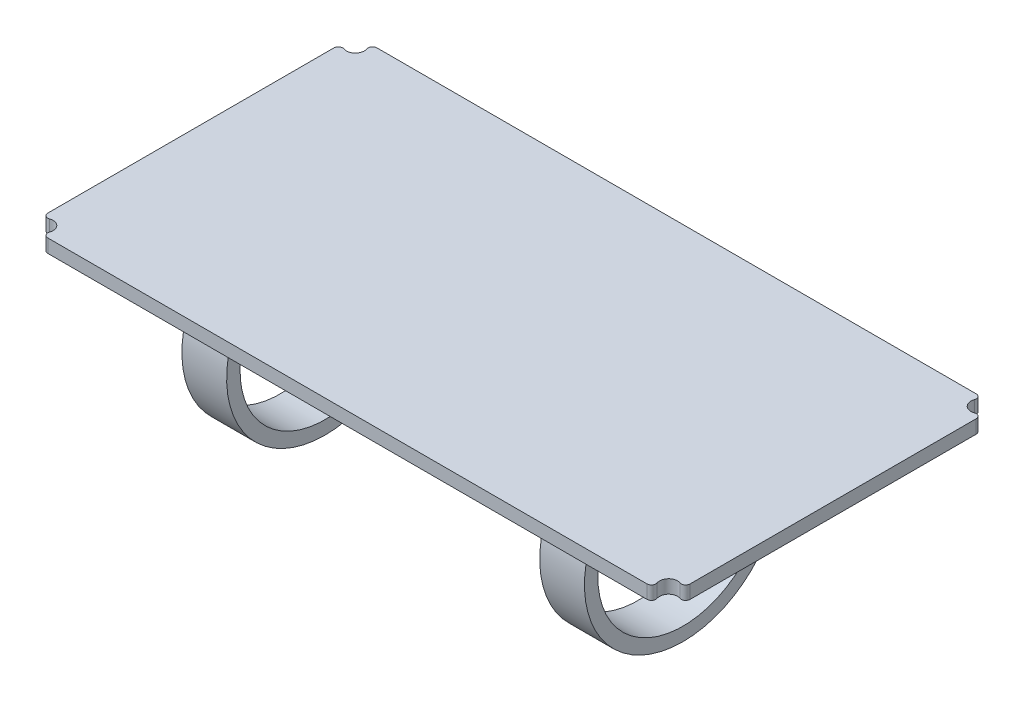
from build123d import *

# Parameters (mm, degrees)
BOSS_EXTRUDE1_DEPTH = 1.5
BOSS_EXTRUDE2_START = -10
BOSS_EXTRUDE2_DEPTH = 5
BOSS_EXTRUDE3_START = -50
BOSS_EXTRUDE3_DEPTH = 5
FILLET1_R           = 5
SKETCH4_R           = 1.1
CUT_EXTRUDE1_DEPTH  = 1.5
SKETCH5_R           = 0.85
CUT_EXTRUDE2_DEPTH  = 6


with BuildPart() as part:
    # Sketch1 → Boss-Extrude1 (new body)
    with BuildSketch(Plane(origin=(0, 0, 0), x_dir=(1, 0, 0), z_dir=(0, 1, 0))):
        with BuildLine():
            Line((2.414213562, 0), (69.385786438, 0))
            ThreePointArc((69.385786438, 0), (69.794034728, 0.211324865), (69.857190958, 0.666666667))
            ThreePointArc((69.857190958, 0.666666667), (70.092893219, 1.707106781), (71.133333333, 1.942809042))
            ThreePointArc((71.133333333, 1.942809042), (71.588675135, 2.005965272), (71.8, 2.414213562))
            Line((71.8, 2.414213562), (71.8, 34.385786438))
            ThreePointArc((71.8, 34.385786438), (71.588675135, 34.794034728), (71.133333333, 34.857190958))
            ThreePointArc((71.133333333, 34.857190958), (70.092893219, 35.092893219), (69.857190958, 36.133333333))
            ThreePointArc((69.857190958, 36.133333333), (69.794034728, 36.588675135), (69.385786438, 36.8))
            Line((69.385786438, 36.8), (2.414213562, 36.8))
            ThreePointArc((2.414213562, 36.8), (2.005965272, 36.588675135), (1.942809042, 36.133333333))
            ThreePointArc((1.942809042, 36.133333333), (1.707106781, 35.092893219), (0.666666667, 34.857190958))
            ThreePointArc((0.666666667, 34.857190958), (0.211324865, 34.794034728), (0, 34.385786438))
            Line((0, 34.385786438), (0, 2.414213562))
            ThreePointArc((0, 2.414213562), (0.211324865, 2.005965272), (0.666666667, 1.942809042))
            ThreePointArc((0.666666667, 1.942809042), (1.707106781, 1.707106781), (1.942809042, 0.666666667))
            ThreePointArc((1.942809042, 0.666666667), (2.005965272, 0.211324865), (2.414213562, 0))
        make_face()
    extrude(amount=BOSS_EXTRUDE1_DEPTH)

    # Sketch3 → Boss-Extrude2 (add)
    with BuildSketch(Plane.ZY.offset(BOSS_EXTRUDE2_START)):
        with BuildLine():
            Line((-18.4, 0), (-30.499127896, 0))
            Line((-30.499127896, 0), (-25.871961194, -3.633161336))
            ThreePointArc((-25.871961194, -3.633161336), (-22.554216695, -0.956436127), (-18.4, 0))
        make_face()
        with BuildLine():
            Line((-12.854731747, 0), (-18.4, 0))
            ThreePointArc((-18.4, 0), (-13.582214371, -17.687731165), (-26.704575482, -4.886538603))
            Line((-26.704575482, -4.886538603), (-31.425470843, -1.179783346))
            Line((-31.425470843, -1.179783346), (-32.35181379, -2.359566693))
            Line((-32.35181379, -2.359566693), (-28.576454789, -5.323905182))
            ThreePointArc((-28.576454789, -5.323905182), (-14.871832802, -19.918830847), (-12.854731747, 0))
        make_face()
    extrude(amount=-BOSS_EXTRUDE2_DEPTH)

    # Sketch3<3> → Boss-Extrude3 (add)
    with BuildSketch(Plane.ZY.offset(BOSS_EXTRUDE3_START)):
        with BuildLine():
            Line((-18.4, 0), (-30.499127896, 0))
            Line((-30.499127896, 0), (-25.871961194, -3.633161336))
            ThreePointArc((-25.871961194, -3.633161336), (-22.554216695, -0.956436127), (-18.4, 0))
        make_face()
        with BuildLine():
            Line((-12.854731747, 0), (-18.4, 0))
            ThreePointArc((-18.4, 0), (-13.582214371, -17.687731165), (-26.704575482, -4.886538603))
            Line((-26.704575482, -4.886538603), (-31.425470843, -1.179783346))
            Line((-31.425470843, -1.179783346), (-32.35181379, -2.359566693))
            Line((-32.35181379, -2.359566693), (-28.576454789, -5.323905182))
            ThreePointArc((-28.576454789, -5.323905182), (-14.871832802, -19.918830847), (-12.854731747, 0))
        make_face()
    extrude(amount=-BOSS_EXTRUDE3_DEPTH)

    # Fillet1
    fillet1_edges = [part.edges().sort_by_distance(p)[0] for p in [
        (52.5, 0, -12.854731747),
        (12.5, 0, -12.854731747),
    ]]
    fillet(fillet1_edges, radius=FILLET1_R)

    # Sketch4 → Cut-Extrude1 (cut)
    with BuildSketch(Plane(origin=(0, -17.173792622, -13.484528084), x_dir=(1, 0, 0), z_dir=(0, -0.7865222309713126, -0.6175619646544867))):
        with Locations((12.5, -21.609183849)):
            Circle(SKETCH4_R)
        with Locations((52.5, -21.609183849)):
            Circle(SKETCH4_R)
    extrude(amount=-CUT_EXTRUDE1_DEPTH, mode=Mode.SUBTRACT)

    # Sketch5 → Cut-Extrude2 (cut)
    with BuildSketch(Plane(origin=(0, -17.173792622, -13.484528084), x_dir=(1, 0, 0), z_dir=(0, -0.7865222309713126, -0.6175619646544867))):
        with Locations((12.5, -21.609183849)):
            Circle(SKETCH5_R)
        with Locations((52.5, -21.609183849)):
            Circle(SKETCH5_R)
    extrude(amount=-CUT_EXTRUDE2_DEPTH, mode=Mode.SUBTRACT)


solid = part.part
